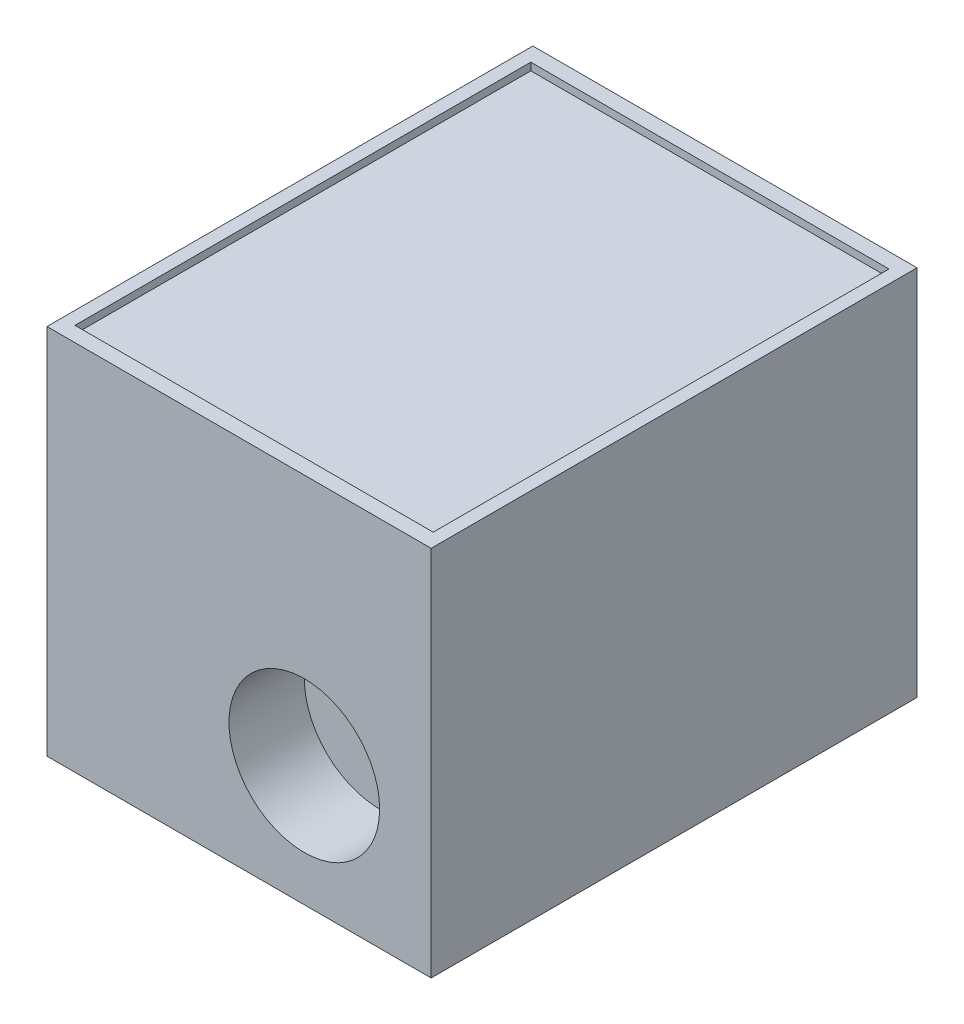
from build123d import *

# Parameters (mm, degrees)
SKETCH1_W           = 51
SKETCH1_H           = 64.5
BOSS_EXTRUDE1_DEPTH = 49.4
SKETCH2_R           = 10
CUT_EXTRUDE1_DEPTH  = 10
SKETCH3_W           = 47.55649051
SKETCH3_H           = 60.50962022
CUT_EXTRUDE2_DEPTH  = 1


with BuildPart() as part:
    # Sketch1 → Boss-Extrude1 (new body)
    with BuildSketch(Plane(origin=(0, 0, 0), x_dir=(1, 0, 0), z_dir=(0, 1, 0))):
        Rectangle(SKETCH1_W, SKETCH1_H)
    extrude(amount=BOSS_EXTRUDE1_DEPTH)

    # Sketch2 → Cut-Extrude1 (cut)
    with BuildSketch(Plane.XY.offset(32.25)):
        with Locations((8.66, 16)):
            Circle(SKETCH2_R)
    extrude(amount=-CUT_EXTRUDE1_DEPTH, mode=Mode.SUBTRACT)

    # Sketch3 → Cut-Extrude2 (cut)
    with BuildSketch(Plane(origin=(0, 49.4, 0), x_dir=(1, 0, 0), z_dir=(0, 1, 0))):
        Rectangle(SKETCH3_W, SKETCH3_H)
    extrude(amount=-CUT_EXTRUDE2_DEPTH, mode=Mode.SUBTRACT)


solid = part.part
